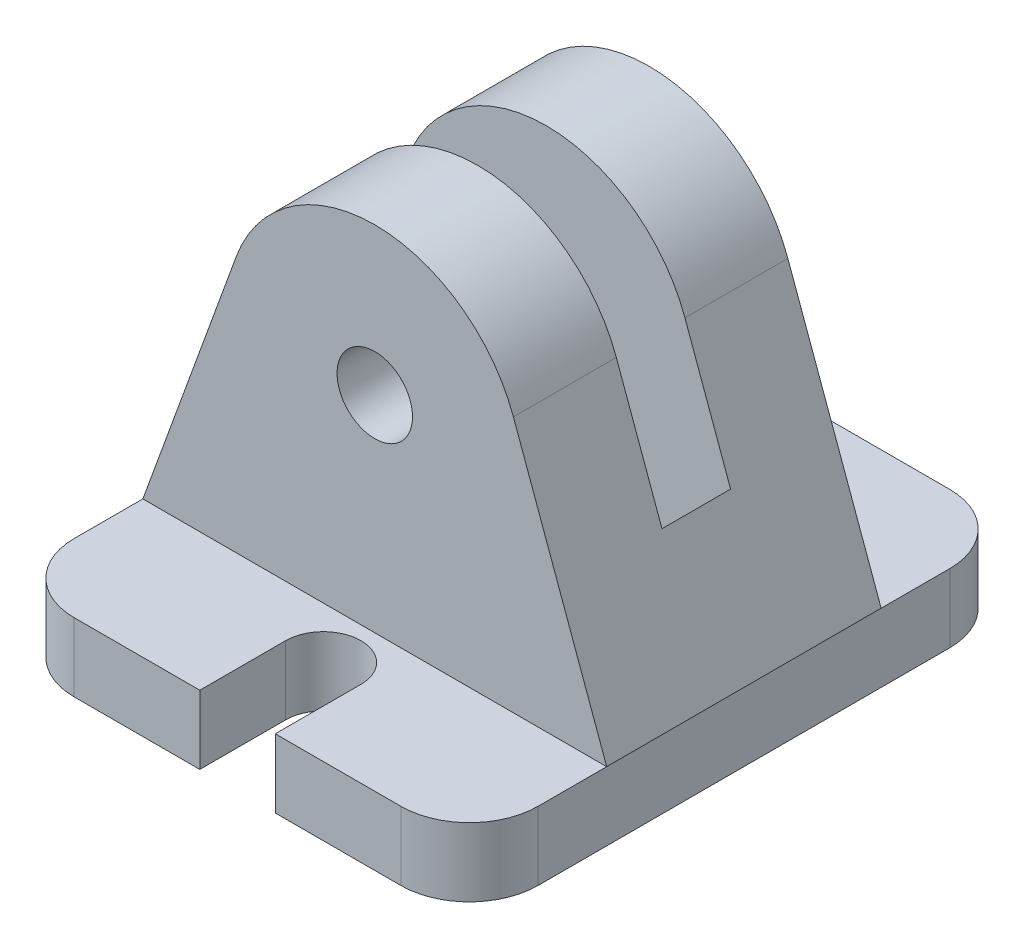
from build123d import *

# Parameters (mm, degrees)
SKETCH1_R           = 2.75
BOSS_EXTRUDE1_DEPTH = 10
SKETCH2_R           = 14.5
CUT_EXTRUDE1_DEPTH  = 2.5
BOSS_EXTRUDE2_DEPTH = 5
CUT_EXTRUDE5_DEPTH  = 41.387552571
SKETCH5_R           = 14.5
CUT_EXTRUDE6_DEPTH  = 2.5


with BuildPart() as part:
    # Sketch1 → Boss-Extrude1 (new, symmetric)
    with BuildSketch(Plane.XY):
        with BuildLine():
            Line((-10.101695673, 3.676716541), (-16.899464568, -15))
            Line((-16.899464568, -15), (16.899464568, -15))
            Line((16.899464568, -15), (10.101695673, 3.676716541))
            ThreePointArc((10.101695673, 3.676716541), (0, 10.75), (-10.101695673, 3.676716541))
        make_face()
        Circle(SKETCH1_R, mode=Mode.SUBTRACT)
    extrude(amount=BOSS_EXTRUDE1_DEPTH, both=True)

    # Sketch2 → Cut-Extrude1 (cut, symmetric)
    with BuildSketch(Plane.XY):
        Circle(SKETCH2_R)
    extrude(amount=CUT_EXTRUDE1_DEPTH, both=True, mode=Mode.SUBTRACT)

    # Sketch3 → Boss-Extrude2 (add)
    with BuildSketch(Plane.XZ.offset(15)):
        with BuildLine():
            Line((-16.899464568, 15), (-16.899464568, 10))
            Line((-16.899464568, 10), (16.899464568, 10))
            Line((16.899464568, 10), (16.899464568, 15))
            ThreePointArc((16.899464568, 15), (15.434998474, 18.535533906), (11.899464568, 20))
            Line((11.899464568, 20), (-11.899464568, 20))
            ThreePointArc((-11.899464568, 20), (-15.434998474, 18.535533906), (-16.899464568, 15))
        make_face()
        Polygon((16.899464568, 10), (-16.899464568, 10), (-16.899464568, -10), (16.899464568, -10), (16.899464568, 0), align=None)
        with BuildLine():
            Line((16.899464568, -10), (-16.899464568, -10))
            Line((-16.899464568, -10), (-16.899464568, -15))
            ThreePointArc((-16.899464568, -15), (-15.434998474, -18.535533906), (-11.899464568, -20))
            Line((-11.899464568, -20), (11.899464568, -20))
            ThreePointArc((11.899464568, -20), (15.434998474, -18.535533906), (16.899464568, -15))
            Line((16.899464568, -15), (16.899464568, -10))
        make_face()
    extrude(amount=BOSS_EXTRUDE2_DEPTH)

    # Sketch4 → Cut-Extrude5 (cut, through all)
    with BuildSketch(Plane.XZ.offset(20)):
        with BuildLine():
            Line((-2.75, 20), (-2.75, 13.75))
            ThreePointArc((-2.75, 13.75), (0, 11), (2.75, 13.75))
            Line((2.75, 13.75), (2.75, 20))
            Line((2.75, 20), (-2.75, 20))
        make_face()
        with BuildLine():
            Line((-2.75, -20), (-2.75, -13.75))
            ThreePointArc((-2.75, -13.75), (0, -11), (2.75, -13.75))
            Line((2.75, -13.75), (2.75, -20))
            Line((2.75, -20), (-2.75, -20))
        make_face()
    extrude(amount=-CUT_EXTRUDE5_DEPTH, mode=Mode.SUBTRACT)

    # Sketch5 → Cut-Extrude6 (cut, symmetric)
    with BuildSketch(Plane.XY):
        Circle(SKETCH5_R)
        with BuildLine():
            ThreePointArc((10.253048327, -10.253048327), (-10.253048327, -10.253048327), (-10.253048327, 10.253048327))
            Line((-10.253048327, 10.253048327), (-31.466251763, -10.960155108))
            Line((-31.466251763, -10.960155108), (-10.960155108, -31.466251763))
            Line((-10.960155108, -31.466251763), (10.253048327, -10.253048327))
        make_face()
    extrude(amount=CUT_EXTRUDE6_DEPTH, both=True, mode=Mode.SUBTRACT)


solid = part.part
